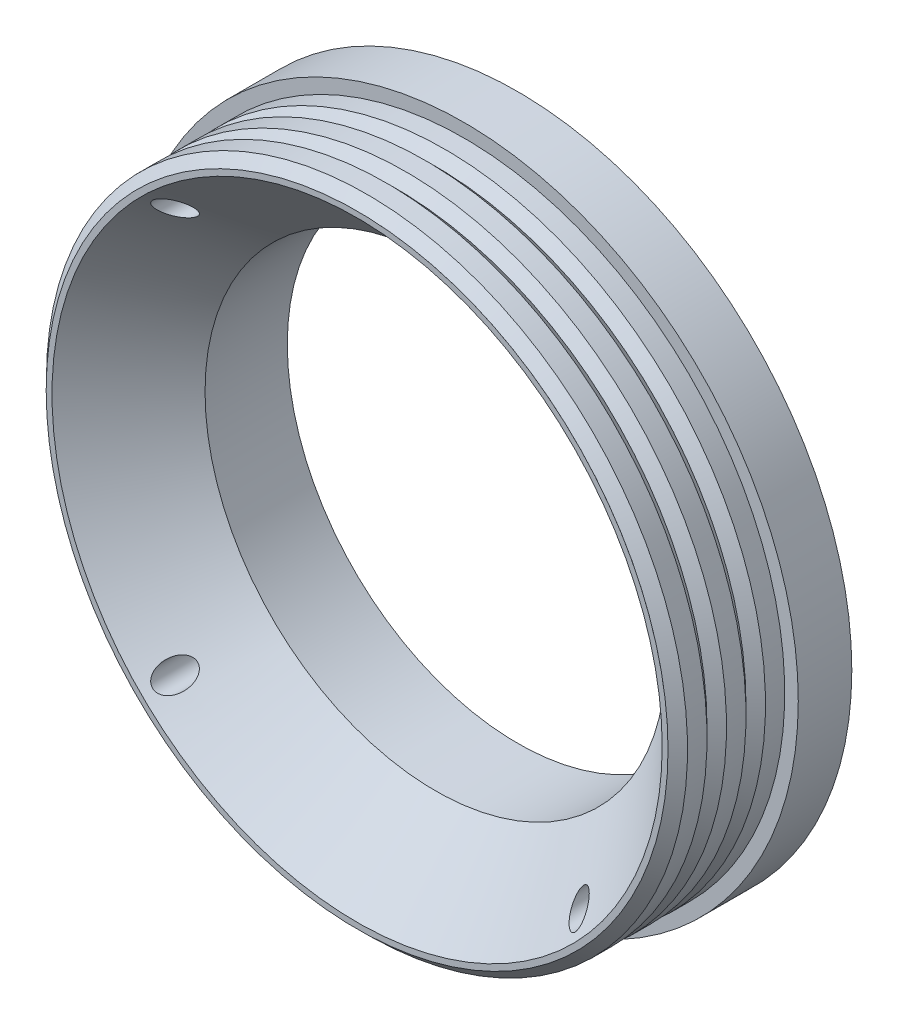
from build123d import *

# Parameters (mm, degrees)
SKETCH2_R                  = 39.624
SKETCH2_R_2                = 27.3304
BOSS_EXTRUDE2_DEPTH        = 6.35
SKETCH5_R                  = 38.018820021
SKETCH5_R_2                = 27.3304
BOSS_EXTRUDE3_DEPTH        = 19.05
F_10_32_TAPPED_HOLE1_D     = 4.0386
F_10_32_TAPPED_HOLE1_DEPTH = 12.7
F_10_32_TAPPED_HOLE1_TIP   = 1.213317848
CUT_EXTRUDE2_DEPTH         = 60.186360354
CUT_EXTRUDE2_DEPTH_BACK    = 60.186360354
SKETCH16_R                 = 1.524


with BuildPart() as part:
    # Sketch2 → Boss-Extrude2 (new body)
    with BuildSketch(Plane.XY):
        Circle(SKETCH2_R)
        Circle(SKETCH2_R_2, mode=Mode.SUBTRACT)
    extrude(amount=BOSS_EXTRUDE2_DEPTH)

    # Sketch5 → Boss-Extrude3 (add)
    with BuildSketch(Plane.XY):
        Circle(SKETCH5_R)
        Circle(SKETCH5_R_2, mode=Mode.SUBTRACT)
    extrude(amount=BOSS_EXTRUDE3_DEPTH)

    # Sketch10 → Cut-Revolve2 (revolve, cut)
    with BuildSketch(Plane(origin=(0, 0, 0), x_dir=(0, 0, -1), z_dir=(1, 0, 0))):
        Polygon((-29.4386, 38.018820021), (-27.1272, 38.018820021), (-28.2829, 36.863120021), align=None)
        Polygon((-24.8158, 38.018820021), (-22.5044, 38.018820021), (-23.6601, 36.863120021), align=None)
        Polygon((-20.193, 38.018820021), (-17.8816, 38.018820021), (-19.0373, 36.863120021), align=None)
        Polygon((-15.5702, 38.018820021), (-13.2588, 38.018820021), (-14.4145, 36.863120021), align=None)
        Polygon((-10.9474, 38.018820021), (-8.636, 38.018820021), (-9.7917, 36.863120021), align=None)
    revolve(axis=Axis((0, 0, 50.084179241), (0, 0, 1)), mode=Mode.SUBTRACT)

    # Sketch11 → Cut-Revolve3 (revolve, cut)
    with BuildSketch(Plane(origin=(0, 0, 0), x_dir=(0, 0, -1), z_dir=(1, 0, 0))):
        Polygon((-19.685, 36.788548166), (-6.35, 24.088548166), (-19.685, 24.088548166), align=None)
    revolve(axis=Axis((0, 0, 43.100386529), (0, 0, 1)), mode=Mode.SUBTRACT)

    # #10-32 Tapped Hole1
    with Locations(Plane(origin=(0, 0, 0), x_dir=(1, 0, 0), z_dir=(0, 0, -1))):
        with Locations((23.671955135, 23.671955135), (0, 0), (23.671955135, -23.671955135), (-23.671955135, 23.671955135), (-23.671955135, -23.671955135)):
            Hole(F_10_32_TAPPED_HOLE1_D / 2, depth=F_10_32_TAPPED_HOLE1_DEPTH)
            with Locations((0, 0, -(F_10_32_TAPPED_HOLE1_DEPTH + F_10_32_TAPPED_HOLE1_TIP / 2))):  # 118° drill point
                Cone(0, F_10_32_TAPPED_HOLE1_D / 2, F_10_32_TAPPED_HOLE1_TIP, mode=Mode.SUBTRACT)

    # Sketch16 → Cut-Extrude2 (cut, two sides: drawn at the far end of the back side and taken through both)
    with BuildSketch(Plane(origin=(0, 0, 0), x_dir=(-1, 0, 0), z_dir=(0, 0, -1)).offset(-CUT_EXTRUDE2_DEPTH_BACK)):
        with Locations((23.977283843, 23.977283843)):
            Circle(SKETCH16_R)
        with Locations((-23.977283843, 23.977283843)):
            Circle(SKETCH16_R)
        with Locations((-23.977283843, -23.977283843)):
            Circle(SKETCH16_R)
        with Locations((23.977283843, -23.977283843)):
            Circle(SKETCH16_R)
    extrude(amount=CUT_EXTRUDE2_DEPTH + CUT_EXTRUDE2_DEPTH_BACK, mode=Mode.SUBTRACT)


solid = part.part
